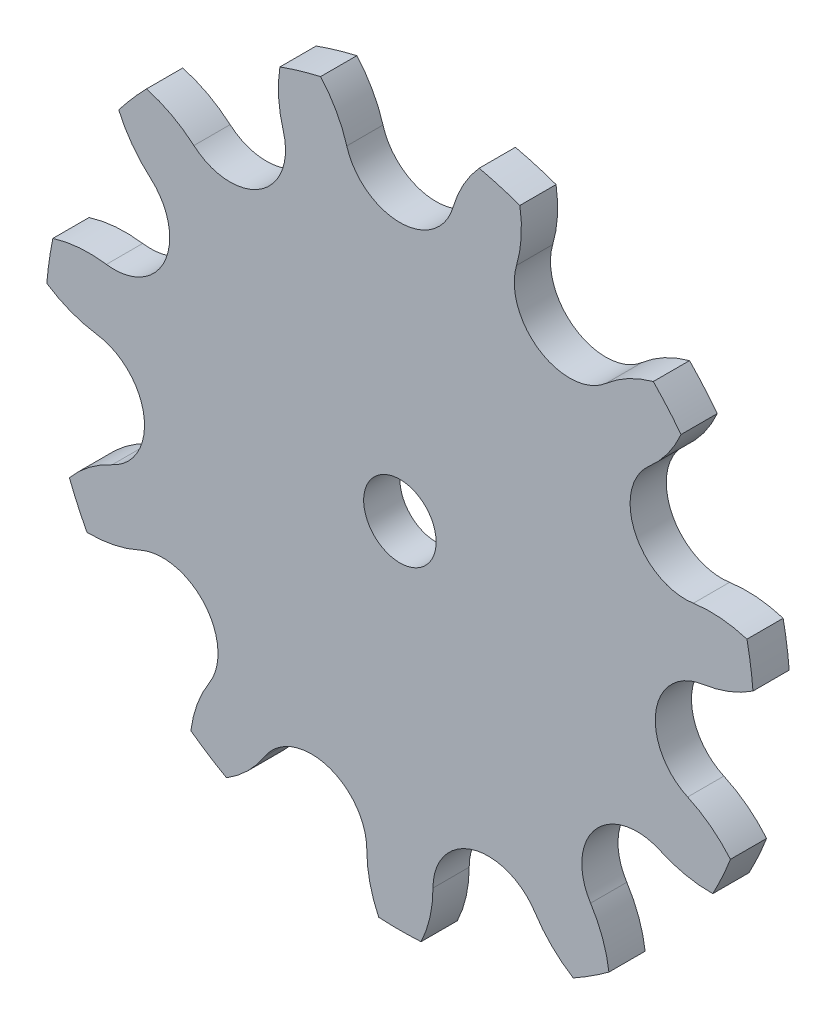
from build123d import *

# Parameters (mm, degrees)
SK_DISCO_R           = 25.436113967
SK_DISCO_R_2         = 2.6
DISCO_DEPTH          = 2.6
HUECO_DIENTE_DEPTH   = 37.065936664
MATRIZ_DIENTES_COUNT = 11


with BuildPart() as part:
    # Sk_Disco → Disco (new body)
    with BuildSketch(Plane.XY):
        Circle(SK_DISCO_R)
        Circle(SK_DISCO_R_2, mode=Mode.SUBTRACT)
    extrude(amount=DISCO_DEPTH)

    # Sk_Hueco → Hueco_diente (cut, through all)
    with BuildSketch(Plane.XY):
        with BuildLine():
            ThreePointArc((-3.81398457, 21.41921922), (0, 18.564106134), (3.81398457, 21.41921922))
            ThreePointArc((3.81398457, 21.41921922), (5.23928173, 24.240764826), (7.576378688, 26.369278253))
            ThreePointArc((7.576378688, 26.369278253), (0, 27.436113967), (-7.576378688, 26.369278253))
            ThreePointArc((-7.576378688, 26.369278253), (-5.23928173, 24.240764826), (-3.81398457, 21.41921922))
        make_face()
    hueco_diente = extrude(amount=HUECO_DIENTE_DEPTH, mode=Mode.SUBTRACT)

    # Matriz_dientes: Hueco_diente ×11 about axis
    matriz_dientes_axis = Axis((0, 0, -0.13), (0, 0, 1))
    for i in range(1, MATRIZ_DIENTES_COUNT):
        add(hueco_diente.rotate(matriz_dientes_axis, i * 360 / MATRIZ_DIENTES_COUNT), mode=Mode.SUBTRACT)


solid = part.part
